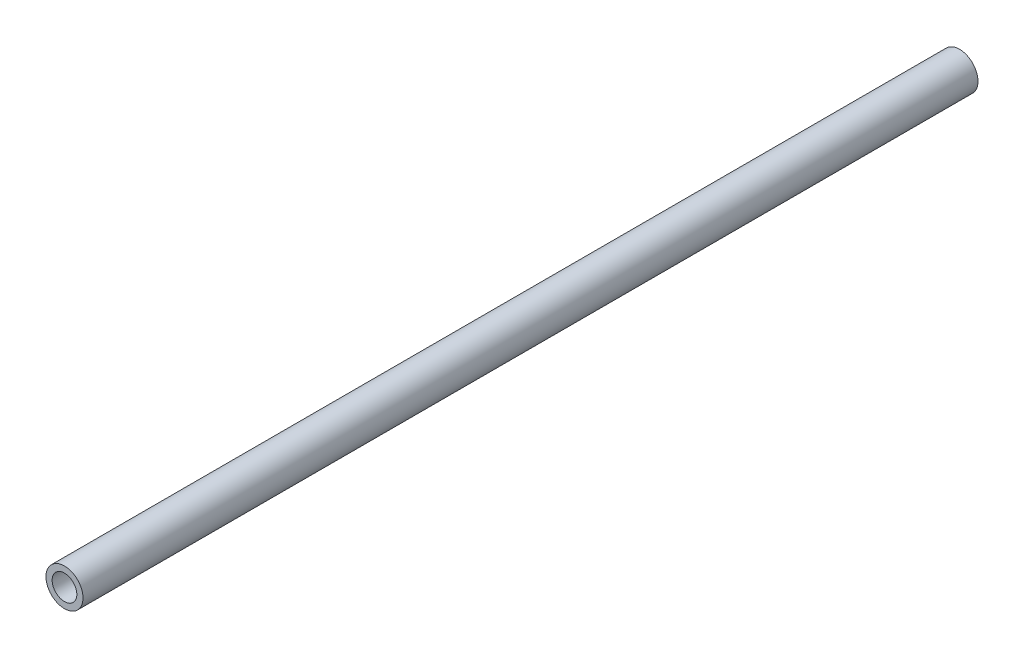
from build123d import *

# Parameters (mm, degrees)
SKETCH1_R           = 3
SKETCH1_R_2         = 2
BOSS_EXTRUDE1_DEPTH = 72.5


with BuildPart() as part:
    # Sketch1 → Boss-Extrude1 (new, symmetric)
    with BuildSketch(Plane.XY):
        Circle(SKETCH1_R)
        Circle(SKETCH1_R_2, mode=Mode.SUBTRACT)
    extrude(amount=BOSS_EXTRUDE1_DEPTH, both=True)


solid = part.part
